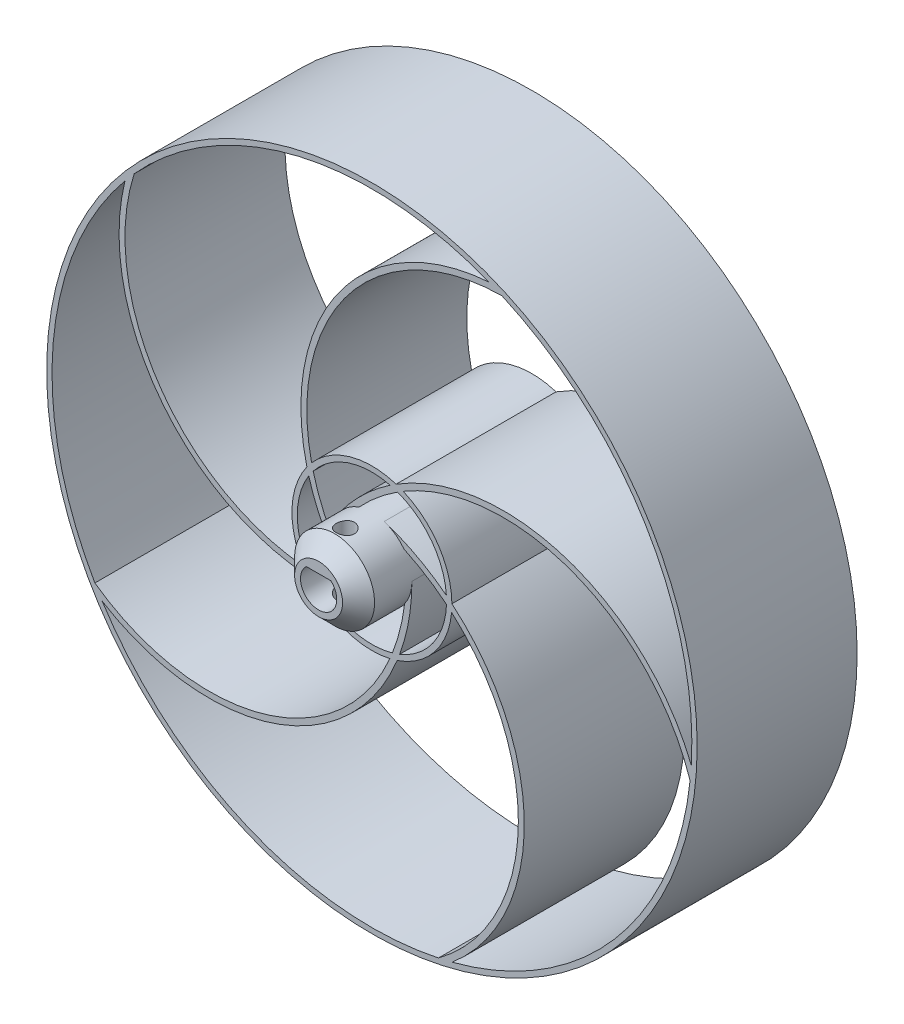
from build123d import *

# Parameters (mm, degrees)
SKETCH1_R               = 30.5
BOSS_EXTRUDE1_DEPTH     = 15
SKETCH2_R               = 3.75
BOSS_EXTRUDE2_DEPTH     = 5
CUT_EXTRUDE1_DEPTH      = 49.356100959
CUT_EXTRUDE1_DEPTH_BACK = 49.356100959
SKETCH3_R               = 0.85
CHAMFER1_SIZE           = 1.5
SKETCH4_R               = 7.5
SKETCH4_R_2             = 7
BOSS_EXTRUDE3_DEPTH     = 15


with BuildPart() as part:
    # Sketch1 → Boss-Extrude1 (new body)
    with BuildSketch(Plane.XY):
        Circle(SKETCH1_R)
        with BuildLine():
            ThreePointArc((-25.980383608, -15.000655572), (-28.977676824, -7.764936953), (-30, 0))
            ThreePointArc((-30, 0), (-28.236730197, 10.133462774), (-23.15419548, 19.075723621))
            ThreePointArc((-23.15419548, 19.075723621), (-17.661279409, 0.599319401), (1.158813729, -3.566461936))
            ThreePointArc((1.158813729, -3.566461936), (2.227035272, -3.017086989), (3.06674754, -2.158137977))
            ThreePointArc((3.06674754, -2.158137977), (-7.792065033, -16.868313668), (-25.980383608, -15.000655572))
        make_face(mode=Mode.SUBTRACT)
        with BuildLine():
            ThreePointArc((6.238091175, -29.344270625), (-11.597022419, -27.667834592), (-25.297131148, -16.126225712))
            ThreePointArc((-25.297131148, -16.126225712), (-6.027622102, -16.611674988), (3.75, 0))
            ThreePointArc((3.75, 0), (3.557611987, 1.185705254), (3.000188293, 2.24974892))
            ThreePointArc((3.000188293, 2.24974892), (13.634839116, -12.623289815), (6.238091175, -29.344270625))
        make_face(mode=Mode.SUBTRACT)
        with BuildLine():
            ThreePointArc((29.835735979, -3.135101049), (22.729997369, -19.579254828), (7.519708613, -29.042279221))
            ThreePointArc((7.519708613, -29.042279221), (13.936004079, -10.865899154), (1.158813729, 3.566461936))
            ThreePointArc((1.158813729, 3.566461936), (-0.028310145, 3.749893137), (-1.212529202, 3.548559276))
            ThreePointArc((-1.212529202, 3.548559276), (16.218859038, 9.066691512), (29.835735979, -3.135101049))
        make_face(mode=Mode.SUBTRACT)
        with BuildLine():
            ThreePointArc((1.152171862, 1.25), (0.682388392, -1.557031176), (-1.7, 0))
            ThreePointArc((-1.7, 0), (-1.557031176, 0.682388392), (-1.152171862, 1.25))
            Line((-1.152171862, 1.25), (1.152171862, 1.25))
        make_face(mode=Mode.SUBTRACT)
        with BuildLine():
            ThreePointArc((-1.104834079, -3.583551543), (-18.450600149, 2.198098635), (-22.294851286, 20.073355628))
            ThreePointArc((-22.294851286, 20.073355628), (-6.880556914, 29.200307131), (10.987051359, 27.91567127))
            ThreePointArc((10.987051359, 27.91567127), (-4.887648858, 16.982074748), (-3.033813729, -2.204194696))
            ThreePointArc((-3.033813729, -2.204194696), (-2.181228495, -3.05036756), (-1.104834079, -3.583551543))
        make_face(mode=Mode.SUBTRACT)
        with BuildLine():
            ThreePointArc((-3.033813729, 2.204194696), (-3.566461936, 1.158813729), (-3.75, 0))
            ThreePointArc((-3.75, 0), (-3.749893137, -0.028310145), (-3.749572552, -0.056618677))
            ThreePointArc((-3.749572552, -0.056618677), (-3.611032972, 18.226813335), (12.201407739, 27.406671618))
            ThreePointArc((12.201407739, 27.406671618), (25.644933357, 15.567189634), (29.944566656, -1.822889958))
            ThreePointArc((29.944566656, -1.822889958), (14.64054629, 9.896179992), (-3.033813729, 2.204194696))
        make_face(mode=Mode.SUBTRACT)
    extrude(amount=BOSS_EXTRUDE1_DEPTH)

    # Sketch2 → Boss-Extrude2 (add)
    with BuildSketch(Plane.XY.offset(15)):
        Circle(SKETCH2_R)
        with BuildLine():
            Line((-1.152171862, 1.25), (1.152171862, 1.25))
            ThreePointArc((1.152171862, 1.25), (0, -1.7), (-1.152171862, 1.25))
        make_face(mode=Mode.SUBTRACT)
    extrude(amount=BOSS_EXTRUDE2_DEPTH)

    # Sketch3 → Cut-Extrude1 (cut, two sides: drawn at the far end of the back side and taken through both)
    with BuildSketch(Plane.XZ.offset(-1.25).offset(-CUT_EXTRUDE1_DEPTH_BACK)):
        with Locations(Location((0, 17.5, 0), (0, 0, 270))):
            Circle(SKETCH3_R)
    extrude(amount=CUT_EXTRUDE1_DEPTH + CUT_EXTRUDE1_DEPTH_BACK, mode=Mode.SUBTRACT)

    # Chamfer1
    chamfer1_edges = [part.edges().sort_by_distance(p)[0] for p in [
        (-3.75, 0, 20),
    ]]
    chamfer(chamfer1_edges, length=CHAMFER1_SIZE)

    # Sketch4 → Boss-Extrude3 (add)
    with BuildSketch(Plane(origin=(0, 0, 0), x_dir=(-1, 0, 0), z_dir=(0, 0, -1))):
        Circle(SKETCH4_R)
        Circle(SKETCH4_R_2, mode=Mode.SUBTRACT)
    extrude(amount=-BOSS_EXTRUDE3_DEPTH)


solid = part.part
